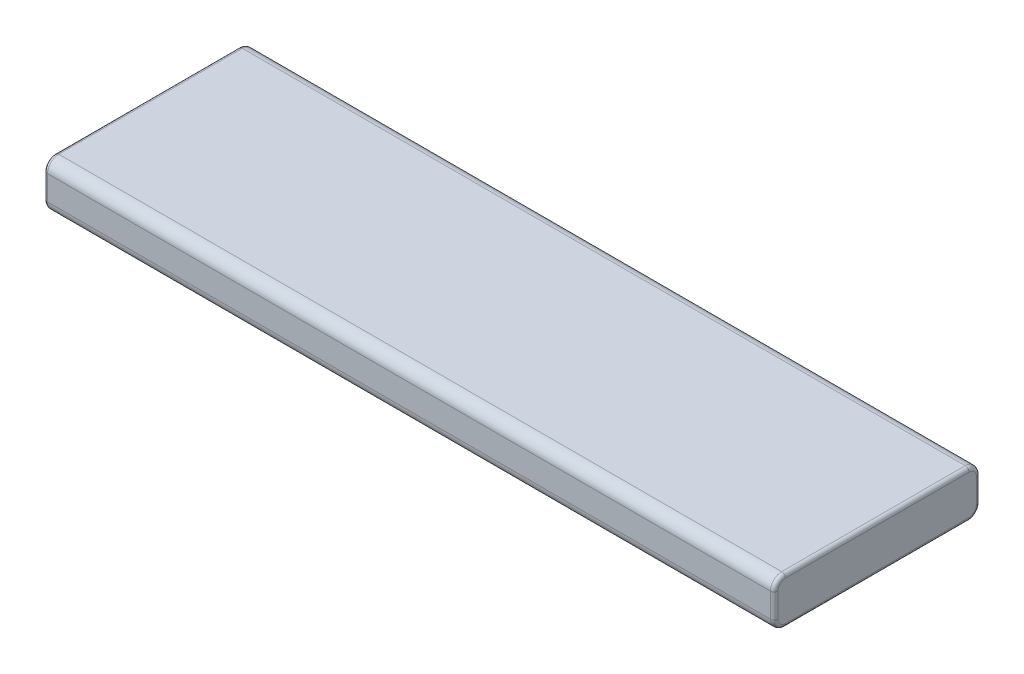
from build123d import *

# Parameters (mm, degrees)
SKETCH_1_W      = 78
SKETCH_1_H      = 22
EXTRUDE_1_DEPTH = 5
FILLET_1_R      = 1.2
FILLET_2_R      = 0.4


with BuildPart() as part:
    # 草图1 → 凸台-拉伸1 (new body)
    with BuildSketch(Plane(origin=(0, 0, 0), x_dir=(1, 0, 0), z_dir=(0, 1, 0))):
        with Locations((39, 11)):
            Rectangle(SKETCH_1_W, SKETCH_1_H)
    extrude(amount=EXTRUDE_1_DEPTH)

    # 圆角1
    fillet_1_edges = [part.edges().sort_by_distance(p)[0] for p in [
        (39, 5, -22),
        (39, 0, -22),
        (39, 0, 0),
        (39, 5, 0),
    ]]
    fillet(fillet_1_edges, radius=FILLET_1_R)

    # 圆角2
    fillet_2_edges = [part.edges().sort_by_distance(p)[0] for p in [
        (0, 2.5, -22),
        (78, 2.5, -22),
        (0, 0, -11),
        (0, 2.5, 0),
        (0, 5, -11),
        (0, 4.648528137, -0.351471863),
        (0, 0.351471863, -0.351471863),
        (0, 4.648528137, -21.648528137),
        (0, 0.351471863, -21.648528137),
        (78, 0, -11),
        (78, 5, -11),
        (78, 2.5, 0),
        (78, 4.648528137, -0.351471863),
        (78, 0.351471863, -0.351471863),
        (78, 4.648528137, -21.648528137),
        (78, 0.351471863, -21.648528137),
    ]]
    fillet(fillet_2_edges, radius=FILLET_2_R)


solid = part.part
